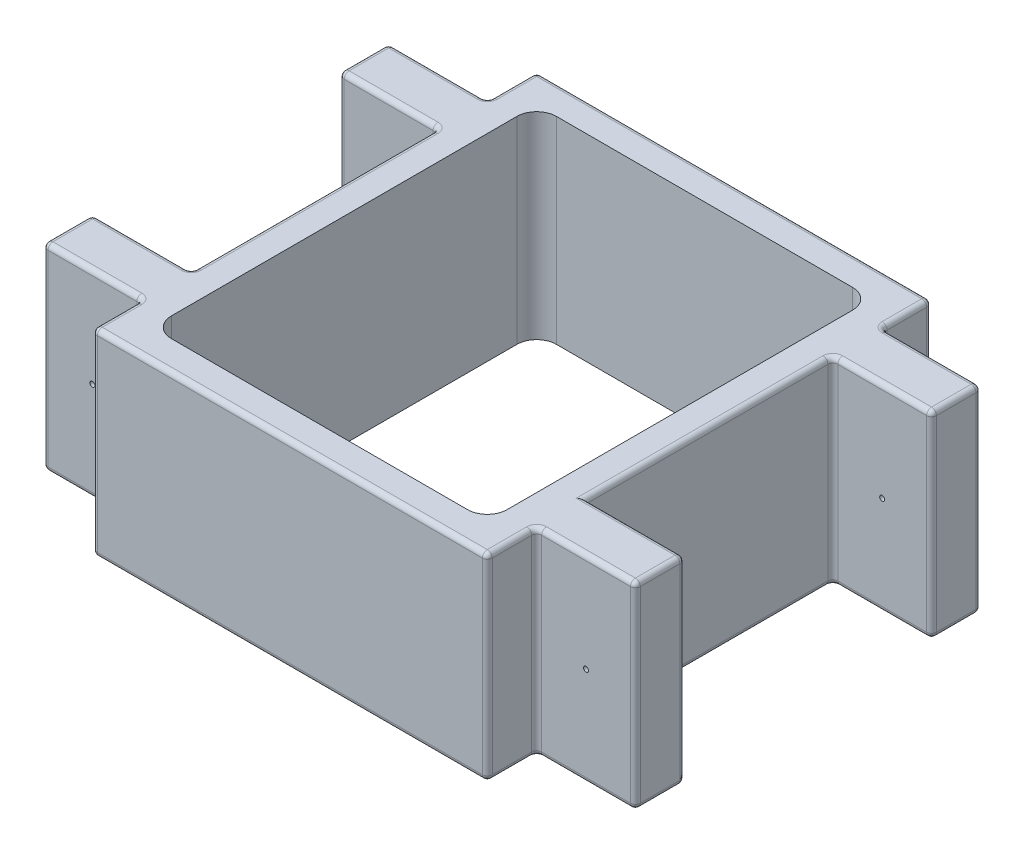
from build123d import *

# Parameters (mm, degrees)
SALIENTE_EXTRUIR1_DEPTH = 2
CROQUIS2_R              = 0.025
CORTAR_EXTRUIR1_DEPTH   = 6.385164807
REDONDEO1_R             = 0.05
CORTAR_EXTRUIR2_DEPTH   = 5.25


with BuildPart() as part:
    # Croquis1 → Saliente-Extruir1 (new body)
    with BuildSketch(Plane(origin=(0, 0, 0), x_dir=(1, 0, 0), z_dir=(0, 1, 0))):
        Polygon((0, -2.25), (0, 2.25), (-2, 2.25), (-2, 1.75), (-3, 1.75), (-3, 1.25), (-2, 1.25), (-2, -1.25), (-3, -1.25), (-3, -1.75), (-2, -1.75), (-2, -2.25), align=None)
    saliente_extruir1 = extrude(amount=SALIENTE_EXTRUIR1_DEPTH)

    # Croquis2 → Cortar-Extruir1 (cut, through all)
    with BuildSketch(Plane.XY.offset(1.75)):
        with Locations((-2.5, 1)):
            Circle(CROQUIS2_R)
    cortar_extruir1 = extrude(amount=-CORTAR_EXTRUIR1_DEPTH, mode=Mode.SUBTRACT)

    # Simetría1: Saliente-Extruir1, Cortar-Extruir1 across plane
    add(saliente_extruir1.mirror(Plane(origin=(0, 0, 0), x_dir=(0, 0, 1), z_dir=(1, 0, 0))))
    add(cortar_extruir1.mirror(Plane(origin=(0, 0, 0), x_dir=(0, 0, 1), z_dir=(1, 0, 0))), mode=Mode.SUBTRACT)

    # Redondeo1
    redondeo1_edges = [part.edges().sort_by_distance(p)[0] for p in [
        (0, 0, 2.25),
        (-2.5, 2, -1.75),
        (-2, 0, 2),
        (-2.5, 0, 1.75),
        (-3, 0, 1.5),
        (-2.5, 0, 1.25),
        (-2, 0, 0),
        (-2.5, 0, -1.25),
        (-3, 0, -1.5),
        (-2.5, 0, -1.75),
        (-2, 0, -2),
        (0, 0, -2.25),
        (-3, 2, -1.5),
        (-2, 1, 2.25),
        (-2.5, 2, -1.25),
        (-2, 1, 1.75),
        (-3, 1, 1.75),
        (-3, 1, 1.25),
        (-2, 1, 1.25),
        (-2, 1, -1.25),
        (-3, 1, -1.25),
        (-3, 1, -1.75),
        (-2, 1, -1.75),
        (-2, 1, -2.25),
        (-2, 2, 0),
        (-2.5, 2, 1.25),
        (-3, 2, 1.5),
        (-2.5, 2, 1.75),
        (-2, 2, 2),
        (0, 2, 2.25),
        (2, 1, -2.25),
        (2, 2, 2),
        (2, 1, 2.25),
        (2.5, 2, 1.75),
        (2, 1, 1.75),
        (3, 2, 1.5),
        (3, 1, 1.75),
        (2.5, 2, 1.25),
        (3, 1, 1.25),
        (2, 2, 0),
        (2.5, 2, -1.25),
        (2, 1, -1.25),
        (3, 2, -1.5),
        (3, 1, -1.25),
        (2.5, 2, -1.75),
        (0, 2, -2.25),
        (3, 1, -1.75),
        (2, 2, -2),
        (2, 1, -1.75),
        (2, 0, -2),
        (2.5, 0, -1.75),
        (3, 0, -1.5),
        (2.5, 0, -1.25),
        (2, 0, 0),
        (2.5, 0, 1.25),
        (3, 0, 1.5),
        (2.5, 0, 1.75),
        (2, 0, 2),
        (-2, 2, -2),
    ]]
    fillet(redondeo1_edges, radius=REDONDEO1_R)

    # Croquis3 → Cortar-Extruir2 (cut, through all)
    with BuildSketch(Plane(origin=(0, 2, 0), x_dir=(1, 0, 0), z_dir=(0, 1, 0))):
        with BuildLine():
            Line((1.5, 1.95), (-1.5, 1.95))
            ThreePointArc((-1.5, 1.95), (-1.641421356, 1.891421356), (-1.7, 1.75))
            Line((-1.7, 1.75), (-1.7, -1.75))
            ThreePointArc((-1.7, -1.75), (-1.641421356, -1.891421356), (-1.5, -1.95))
            Line((-1.5, -1.95), (1.5, -1.95))
            ThreePointArc((1.5, -1.95), (1.641421356, -1.891421356), (1.7, -1.75))
            Line((1.7, -1.75), (1.7, 1.75))
            ThreePointArc((1.7, 1.75), (1.641421356, 1.891421356), (1.5, 1.95))
        make_face()
    extrude(amount=-CORTAR_EXTRUIR2_DEPTH, mode=Mode.SUBTRACT)


solid = part.part
